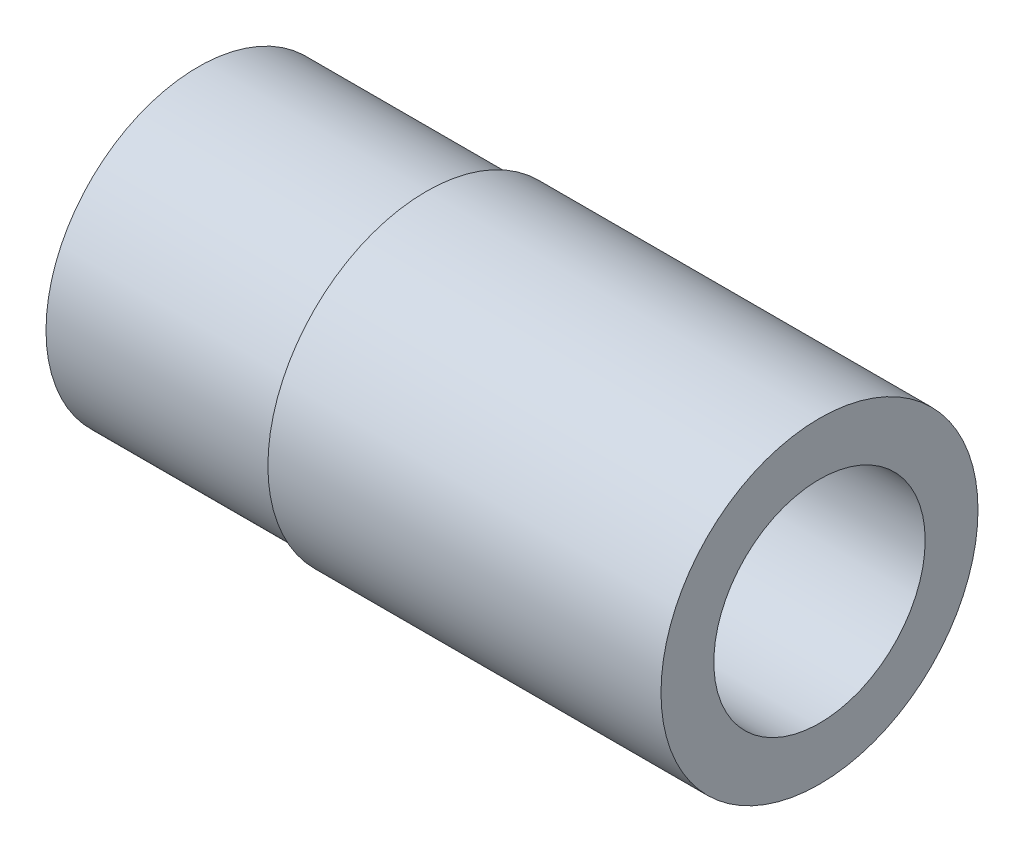
from build123d import *

# Parameters (mm, degrees)
SKETCH1_R           = 37.5
BOSS_EXTRUDE1_DEPTH = 73.5
SKETCH2_R           = 21
CUT_EXTRUDE1_DEPTH  = 157.273798188
SKETCH3_R           = 25
CUT_EXTRUDE2_DEPTH  = 36.5
SKETCH4_W           = 12
SKETCH4_H           = 20.96554604
CUT_EXTRUDE3_DEPTH  = 110.5
FILLET1_R           = 0.5
SKETCH5_W           = 54
SKETCH5_H           = 1.5


with BuildPart() as part:
    # Sketch1 → Boss-Extrude1 (new, symmetric)
    with BuildSketch(Plane(origin=(0, 0, 0), x_dir=(0, 0, -1), z_dir=(1, 0, 0))):
        Circle(SKETCH1_R)
    extrude(amount=BOSS_EXTRUDE1_DEPTH, both=True)

    # Sketch2 → Cut-Extrude1 (cut, through all)
    with BuildSketch(Plane(origin=(73.5, 0, 0), x_dir=(0, 0, -1), z_dir=(1, 0, 0))):
        Circle(SKETCH2_R)
    extrude(amount=-CUT_EXTRUDE1_DEPTH, mode=Mode.SUBTRACT)

    # Sketch3 → Cut-Extrude2 (cut)
    with BuildSketch(Plane(origin=(73.5, 0, 0), x_dir=(0, 0, -1), z_dir=(1, 0, 0))):
        Circle(SKETCH3_R)
    extrude(amount=-CUT_EXTRUDE2_DEPTH, mode=Mode.SUBTRACT)

    # Sketch4 → Cut-Extrude3 (cut)
    with BuildSketch(Plane.ZY.offset(73.5)):
        with Locations((0, 13.81722698)):
            Rectangle(SKETCH4_W, SKETCH4_H)
    extrude(amount=-CUT_EXTRUDE3_DEPTH, mode=Mode.SUBTRACT)

    # Fillet1
    fillet1_edges = [part.edges().sort_by_distance(p)[0] for p in [
        (37, -21, 0),
    ]]
    fillet(fillet1_edges, radius=FILLET1_R)

    # Sketch5 → Cut-Revolve1 (revolve, cut)
    with BuildSketch(Plane.XY, mode=Mode.PRIVATE) as cut_revolve1_sk:
        with Locations((-46.5, 36.75)):
            Rectangle(SKETCH5_W, SKETCH5_H)
    revolve(cut_revolve1_sk.sketch.rotate(Axis((-73.5, 0, 0), (1, 0, 0)), 90), axis=Axis((-73.5, 0, 0), (1, 0, 0)), mode=Mode.SUBTRACT)


solid = part.part
